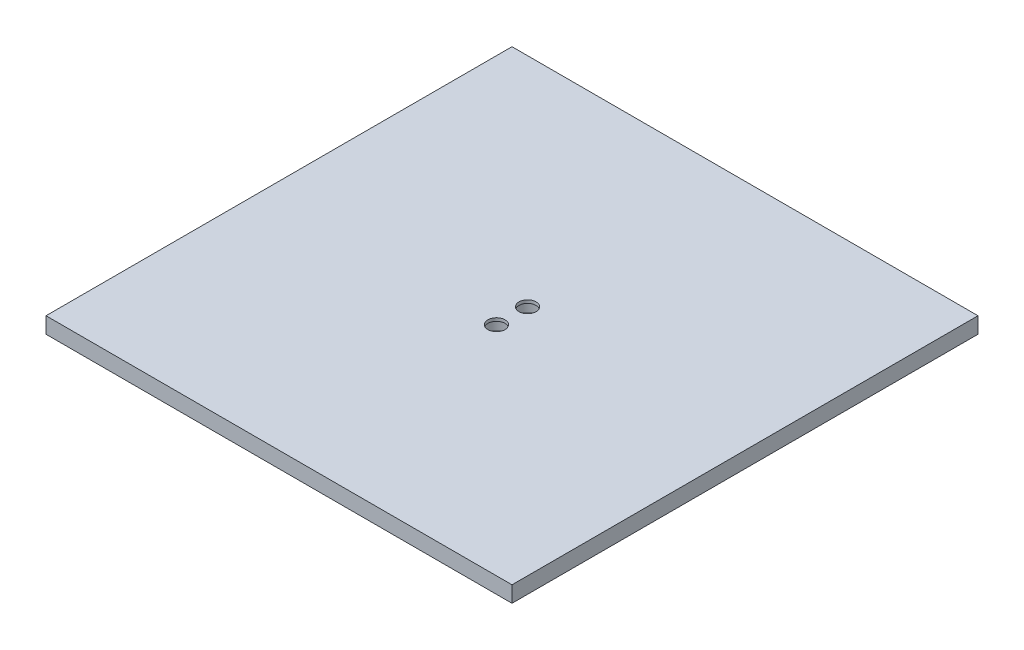
from build123d import *

# Parameters (mm, degrees)
SKETCH1_W           = 90
SKETCH1_H           = 90
BOSS_EXTRUDE1_DEPTH = 3.1
SKETCH2_R           = 1.65
CUT_EXTRUDE1_DEPTH  = 128.316966662
SKETCH5_R           = 2.95
CUT_EXTRUDE2_DEPTH  = 2.5


with BuildPart() as part:
    # Sketch1 → Boss-Extrude1 (new body)
    with BuildSketch(Plane(origin=(0, 0, 0), x_dir=(1, 0, 0), z_dir=(0, 1, 0))):
        with Locations((45, 45)):
            Rectangle(SKETCH1_W, SKETCH1_H)
    extrude(amount=-BOSS_EXTRUDE1_DEPTH)

    # Sketch2 → Cut-Extrude1 (cut, through all)
    with BuildSketch(Plane.XZ.offset(3.1)):
        with Locations(Location((45, -42, 0), (0, 0, 270))):
            Circle(SKETCH2_R)
        with Locations(Location((45, -48, 0), (0, 0, 270))):
            Circle(SKETCH2_R)
    extrude(amount=-CUT_EXTRUDE1_DEPTH, mode=Mode.SUBTRACT)

    # Sketch5 → Cut-Extrude2 (cut)
    with BuildSketch(Plane.XZ.offset(3.1)):
        with Locations(Location((45, -42, 0), (0, 0, 270))):
            Circle(SKETCH5_R)
        with Locations(Location((45, -48, 0), (0, 0, 270))):
            Circle(SKETCH5_R)
    extrude(amount=-CUT_EXTRUDE2_DEPTH, mode=Mode.SUBTRACT)


solid = part.part
